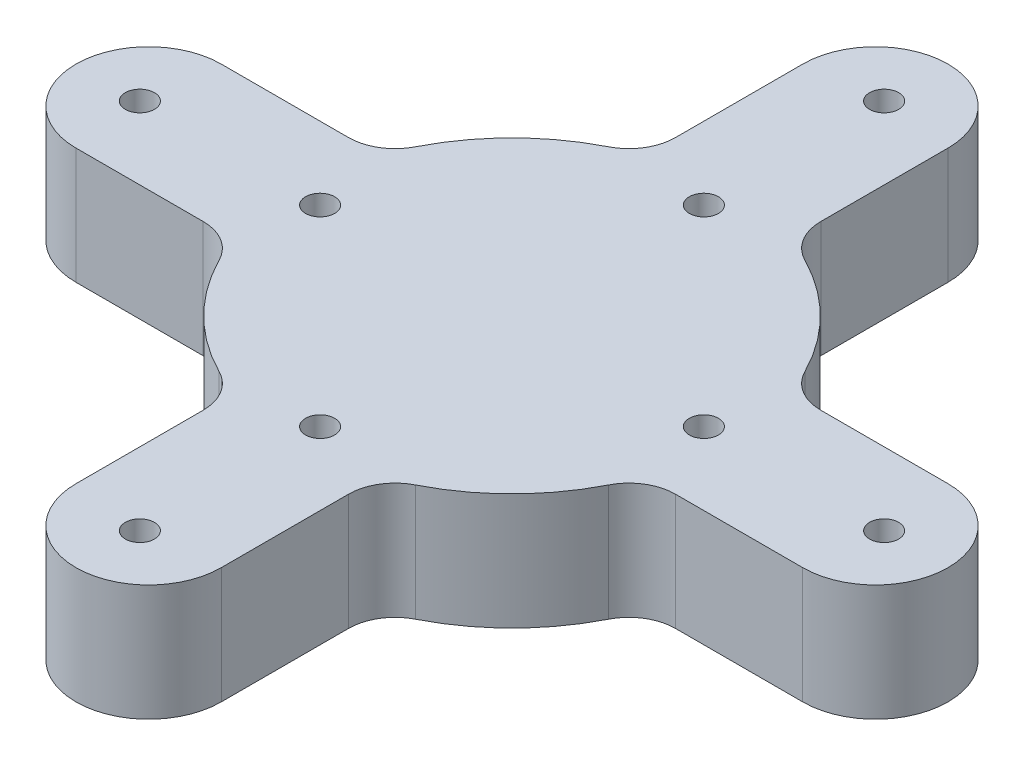
from build123d import *

# Parameters (mm, degrees)
SKETCH2_W           = 25
SKETCH2_H           = 62.5
SKETCH2_H_2         = 25
SKETCH2_W_2         = 62.5
BOSS_EXTRUDE3_DEPTH = 20
FILLET1_R           = 10
FILLET2_R           = 10
FILLET3_R           = 10
FILLET4_R           = 10
FILLET5_RADIUS      = 12.5
FILLET5_LENGTH      = 20
FILLET6_RADIUS      = 12.5
FILLET6_LENGTH      = 20
FILLET7_RADIUS      = 12.5
FILLET7_LENGTH      = 20
FILLET8_RADIUS      = 12.5
FILLET8_LENGTH      = 20
SKETCH4_R           = 2.5
CUT_EXTRUDE2_DEPTH  = 25
SKETCH5_R           = 37.5
BOSS_EXTRUDE4_DEPTH = 20
SKETCH7_R           = 2.5
CUT_EXTRUDE3_DEPTH  = 25
FILLET9_R           = 8


with BuildPart() as part:
    # Sketch2 → Boss-Extrude3 (new body)
    with BuildSketch(Plane(origin=(0, 0, 0), x_dir=(1, 0, 0), z_dir=(0, 1, 0))):
        with Locations((0, -43.75)):
            Rectangle(SKETCH2_W, SKETCH2_H)
        Rectangle(SKETCH2_W, SKETCH2_H_2)
        with Locations((0, 43.75)):
            Rectangle(SKETCH2_W, SKETCH2_H)
        with Locations((-43.75, 0)):
            Rectangle(SKETCH2_W_2, SKETCH2_H_2)
        with Locations((43.75, 0)):
            Rectangle(SKETCH2_W_2, SKETCH2_H_2)
    extrude(amount=BOSS_EXTRUDE3_DEPTH)

    # Fillet1
    fillet1_edges = [part.edges().sort_by_distance(p)[0] for p in [
        (-12.5, 10, 12.5),
    ]]
    fillet(fillet1_edges, radius=FILLET1_R)

    # Fillet2
    fillet2_edges = [part.edges().sort_by_distance(p)[0] for p in [
        (12.5, 10, 12.5),
    ]]
    fillet(fillet2_edges, radius=FILLET2_R)

    # Fillet3
    fillet3_edges = [part.edges().sort_by_distance(p)[0] for p in [
        (-12.5, 10, -12.5),
    ]]
    fillet(fillet3_edges, radius=FILLET3_R)

    # Fillet4
    fillet4_edges = [part.edges().sort_by_distance(p)[0] for p in [
        (12.5, 10, -12.5),
    ]]
    fillet(fillet4_edges, radius=FILLET4_R)

    # Fillet5: full round fillet: the end face becomes a half cylinder, R = half its width
    fillet5_face = Plane((75, 10, 0), x_dir=(0, 1, 0), z_dir=(1, 0, 0))  # on the end face: x along it, z out of the body
    fillet5_slab = fillet5_face.offset(-FILLET5_RADIUS / 2) * Box(FILLET5_LENGTH, 2 * FILLET5_RADIUS, FILLET5_RADIUS, mode=Mode.PRIVATE)  # the body's end, R deep
    fillet5_round = Plane((62.5, 10, 0), x_dir=(1, 0, 0), z_dir=(0, 1, 0)) * Cylinder(FILLET5_RADIUS, FILLET5_LENGTH, mode=Mode.PRIVATE)  # its axis R under the face
    add(fillet5_slab - fillet5_round, mode=Mode.SUBTRACT)

    # Fillet6: full round fillet: the end face becomes a half cylinder, R = half its width
    fillet6_face = Plane((0, 10, 75), x_dir=(0, 1, 0), z_dir=(0, 0, 1))  # on the end face: x along it, z out of the body
    fillet6_slab = fillet6_face.offset(-FILLET6_RADIUS / 2) * Box(FILLET6_LENGTH, 2 * FILLET6_RADIUS, FILLET6_RADIUS, mode=Mode.PRIVATE)  # the body's end, R deep
    fillet6_round = Plane((0, 10, 62.5), x_dir=(0, 0, 1), z_dir=(0, 1, 0)) * Cylinder(FILLET6_RADIUS, FILLET6_LENGTH, mode=Mode.PRIVATE)  # its axis R under the face
    add(fillet6_slab - fillet6_round, mode=Mode.SUBTRACT)

    # Fillet7: full round fillet: the end face becomes a half cylinder, R = half its width
    fillet7_face = Plane((-75, 10, 0), x_dir=(0, 1, 0), z_dir=(-1, 0, 0))  # on the end face: x along it, z out of the body
    fillet7_slab = fillet7_face.offset(-FILLET7_RADIUS / 2) * Box(FILLET7_LENGTH, 2 * FILLET7_RADIUS, FILLET7_RADIUS, mode=Mode.PRIVATE)  # the body's end, R deep
    fillet7_round = Plane((-62.5, 10, 0), x_dir=(-1, 0, 0), z_dir=(0, 1, 0)) * Cylinder(FILLET7_RADIUS, FILLET7_LENGTH, mode=Mode.PRIVATE)  # its axis R under the face
    add(fillet7_slab - fillet7_round, mode=Mode.SUBTRACT)

    # Fillet8: full round fillet: the end face becomes a half cylinder, R = half its width
    fillet8_face = Plane((0, 10, -75), x_dir=(0, 1, 0), z_dir=(0, 0, -1))  # on the end face: x along it, z out of the body
    fillet8_slab = fillet8_face.offset(-FILLET8_RADIUS / 2) * Box(FILLET8_LENGTH, 2 * FILLET8_RADIUS, FILLET8_RADIUS, mode=Mode.PRIVATE)  # the body's end, R deep
    fillet8_round = Plane((0, 10, -62.5), x_dir=(0, 0, -1), z_dir=(0, 1, 0)) * Cylinder(FILLET8_RADIUS, FILLET8_LENGTH, mode=Mode.PRIVATE)  # its axis R under the face
    add(fillet8_slab - fillet8_round, mode=Mode.SUBTRACT)

    # Sketch4 → Cut-Extrude2 (cut)
    with BuildSketch(Plane(origin=(0, 20, 0), x_dir=(1, 0, 0), z_dir=(0, 1, 0))):
        with Locations(Location((64, 0, 0), (0, 0, 270))):
            Circle(SKETCH4_R)
        with Locations(Location((0, -64, 0), (0, 0, 270))):
            Circle(SKETCH4_R)
        with Locations(Location((-64, 0, 0), (0, 0, 270))):
            Circle(SKETCH4_R)
        with Locations(Location((0, 64, 0), (0, 0, 270))):
            Circle(SKETCH4_R)
    extrude(amount=-CUT_EXTRUDE2_DEPTH, mode=Mode.SUBTRACT)

    # Sketch5 → Boss-Extrude4 (add)
    with BuildSketch(Plane(origin=(0, 20, 0), x_dir=(1, 0, 0), z_dir=(0, 1, 0))):
        Circle(SKETCH5_R)
    extrude(amount=-BOSS_EXTRUDE4_DEPTH)

    # Sketch7 → Cut-Extrude3 (cut)
    with BuildSketch(Plane(origin=(0, 20, 0), x_dir=(1, 0, 0), z_dir=(0, 1, 0))):
        with Locations(Location((0, 33, 0), (0, 0, 270))):
            Circle(SKETCH7_R)
        with Locations(Location((33, 0, 0), (0, 0, 270))):
            Circle(SKETCH7_R)
        with Locations(Location((0, -33, 0), (0, 0, 270))):
            Circle(SKETCH7_R)
        with Locations(Location((-33, 0, 0), (0, 0, 270))):
            Circle(SKETCH7_R)
    extrude(amount=-CUT_EXTRUDE3_DEPTH, mode=Mode.SUBTRACT)

    # Fillet9
    fillet9_edges = [part.edges().sort_by_distance(p)[0] for p in [
        (12.5, 10, 35.355339059),
        (35.355339059, 10, 12.5),
        (35.355339059, 10, -12.5),
        (12.5, 10, -35.355339059),
        (-35.355339059, 10, 12.5),
        (-12.5, 10, 35.355339059),
        (-12.5, 10, -35.355339059),
        (-35.355339059, 10, -12.5),
    ]]
    fillet(fillet9_edges, radius=FILLET9_R)


solid = part.part
